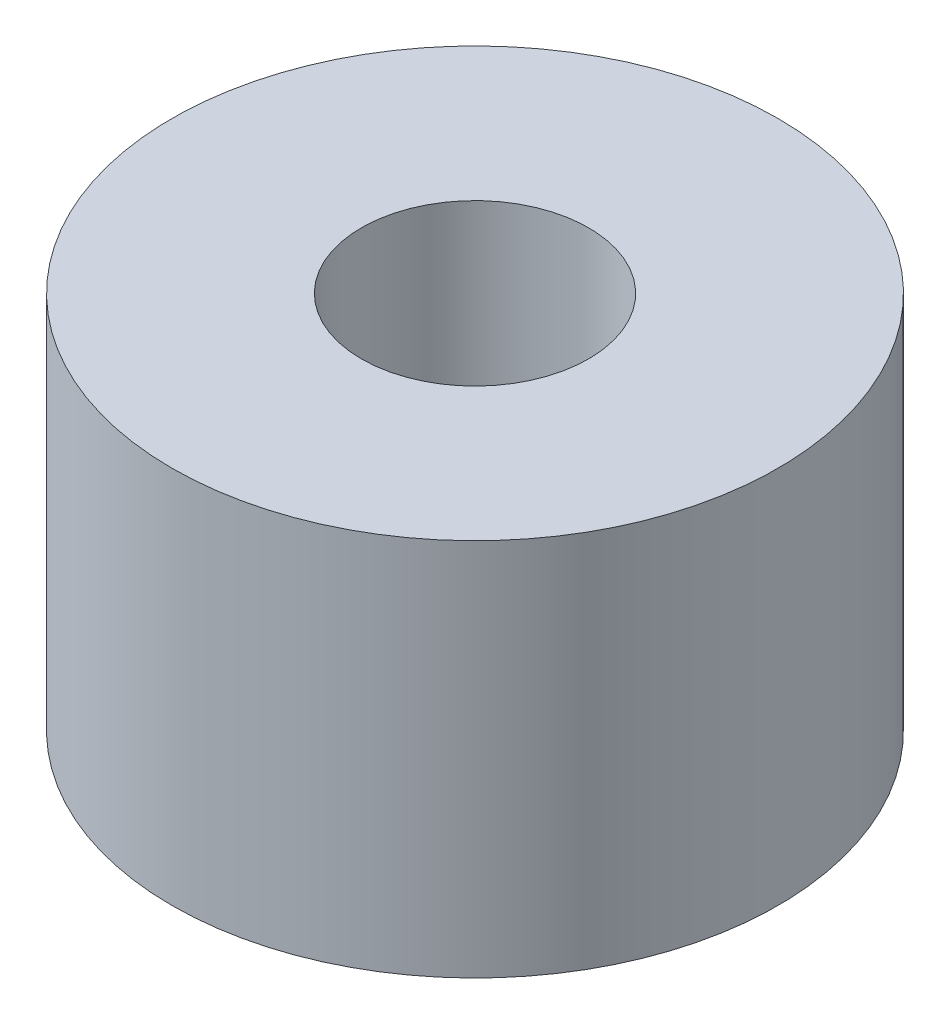
from build123d import *

# Parameters (mm, degrees)
SKETCH_1_R      = 4
SKETCH_1_R_2    = 1.5
EXTRUDE_1_DEPTH = 5


with BuildPart() as part:
    # 草图1 → 凸台-拉伸1 (new body)
    with BuildSketch(Plane(origin=(0, 0, 0), x_dir=(1, 0, 0), z_dir=(0, 1, 0))):
        with Locations(Location((0, 0, 0), (0, 0, 270))):
            Circle(SKETCH_1_R)
        with Locations(Location((0, 0, 0), (0, 0, 270))):
            Circle(SKETCH_1_R_2, mode=Mode.SUBTRACT)
    extrude(amount=EXTRUDE_1_DEPTH)


solid = part.part
